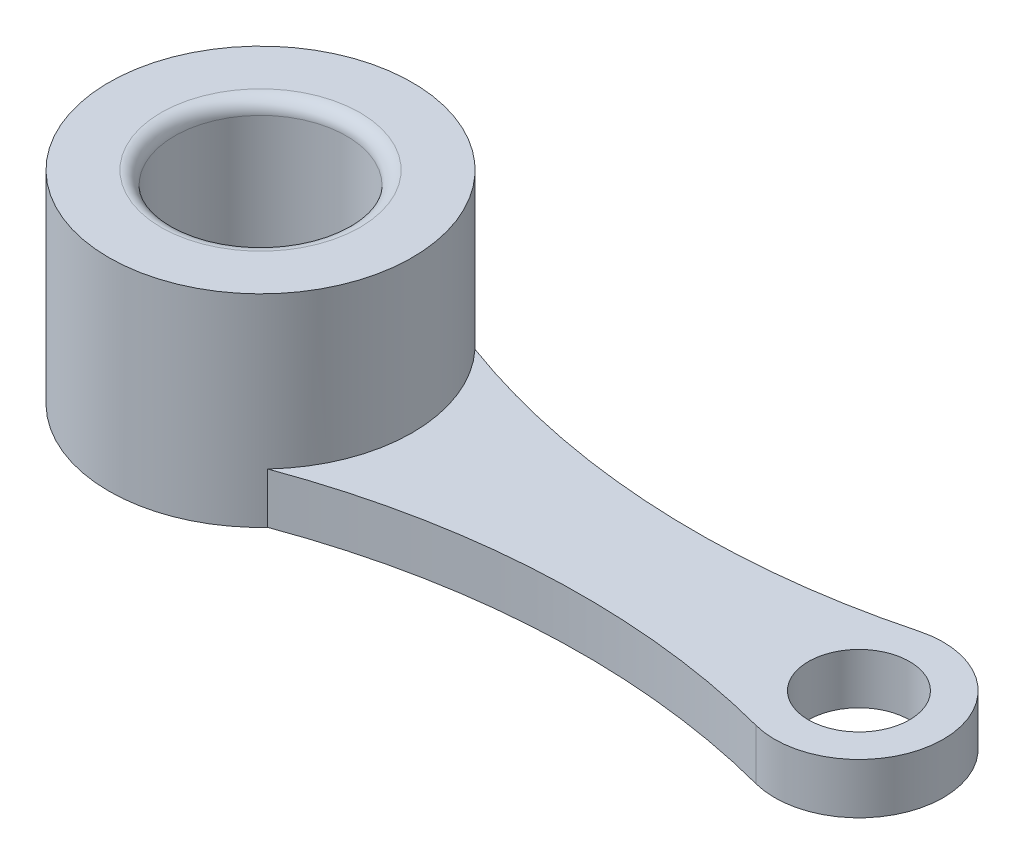
from build123d import *

# Parameters (mm, degrees)
SKETCH2_W               = 25
SKETCH2_H               = 9
BOSS_EXTRUDE3_DEPTH     = 6
SKETCH3_R               = 2.55
CUT_EXTRUDE1_DEPTH      = 5
CUT_EXTRUDE2_DEPTH      = 28.239676944
CUT_EXTRUDE2_DEPTH_BACK = 28.239676944
SKETCH4_R               = 1.5
SKETCH5_R               = 1.5
CUT_EXTRUDE3_DEPTH      = 4.5
CUT_EXTRUDE4_DEPTH      = 28.239676944
FILLET2_R               = 0.4
SKETCH8_R               = 1
CUT_EXTRUDE5_DEPTH      = 28.239676944
CUT_EXTRUDE7_DEPTH      = 10


with BuildPart() as part:
    # Sketch2 → Boss-Extrude3 (new body)
    with BuildSketch(Plane(origin=(0, 0, 0), x_dir=(1, 0, 0), z_dir=(0, 1, 0))):
        with Locations((12.5, 4.5)):
            Rectangle(SKETCH2_W, SKETCH2_H)
    extrude(amount=BOSS_EXTRUDE3_DEPTH)

    # Sketch3 → Cut-Extrude1 (cut)
    with BuildSketch(Plane(origin=(0, 6, 0), x_dir=(1, 0, 0), z_dir=(0, 1, 0))):
        with Locations(Location((4.5, 4.5, 0), (0, 0, 270))):
            Circle(SKETCH3_R)
    extrude(amount=-CUT_EXTRUDE1_DEPTH, mode=Mode.SUBTRACT)

    # Sketch4 → Cut-Extrude2 (cut, two sides: drawn at the far end of the back side and taken through both)
    with BuildSketch(Plane(origin=(0, 6, 0), x_dir=(1, 0, 0), z_dir=(0, 1, 0)).offset(-CUT_EXTRUDE2_DEPTH_BACK)):
        with Locations(Location((22.25, 4.5, 0), (0, 0, 270))):
            Circle(SKETCH4_R)
    extrude(amount=CUT_EXTRUDE2_DEPTH + CUT_EXTRUDE2_DEPTH_BACK, mode=Mode.SUBTRACT)

    # Sketch5 → Cut-Extrude3 (cut)
    with BuildSketch(Plane(origin=(0, 6, 0), x_dir=(1, 0, 0), z_dir=(0, 1, 0))):
        with BuildLine():
            Line((25, 9), (4.5, 9))
            ThreePointArc((4.5, 9), (7.681980515, 7.681980515), (9, 4.5))
            ThreePointArc((9, 4.5), (7.681980515, 1.318019485), (4.5, 0))
            Line((4.5, 0), (25, 0))
            Line((25, 0), (25, 9))
        make_face()
        with Locations(Location((22.25, 4.5, 0), (0, 0, 270))):
            Circle(SKETCH5_R, mode=Mode.SUBTRACT)
    extrude(amount=-CUT_EXTRUDE3_DEPTH, mode=Mode.SUBTRACT)

    # Sketch6 → Cut-Extrude4 (cut, through all)
    with BuildSketch(Plane(origin=(0, 6, 0), x_dir=(1, 0, 0), z_dir=(0, 1, 0))):
        with BuildLine():
            ThreePointArc((0, 4.5), (1.318019485, 7.681980515), (4.5, 9))
            Line((4.5, 9), (0, 9))
            Line((0, 9), (0, 4.5))
        make_face()
        with BuildLine():
            ThreePointArc((4.5, 0), (1.318019485, 1.318019485), (0, 4.5))
            Line((0, 4.5), (0, 0))
            Line((0, 0), (4.5, 0))
        make_face()
    extrude(amount=-CUT_EXTRUDE4_DEPTH, mode=Mode.SUBTRACT)

    # Fillet2
    fillet2_edges = [part.edges().sort_by_distance(p)[0] for p in [
        (4.5, 6, -7.05),
    ]]
    fillet(fillet2_edges, radius=FILLET2_R)

    # Sketch8 → Cut-Extrude5 (cut, through all)
    with BuildSketch(Plane.XZ):
        with Locations(Location((4.5, -4.5, 0), (0, 0, 270))):
            Circle(SKETCH8_R)
    extrude(amount=-CUT_EXTRUDE5_DEPTH, mode=Mode.SUBTRACT)

    # Sketch9 → Cut-Extrude7 (cut)
    with BuildSketch(Plane(origin=(0, 1.5, 0), x_dir=(1, 0, 0), z_dir=(0, 1, 0))):
        with BuildLine():
            Line((25, 9), (4.5, 9))
            ThreePointArc((4.5, 9), (6.291176984, 8.628157581), (7.786338153, 7.574082228))
            ThreePointArc((7.786338153, 7.574082228), (14.648850695, 6.181991531), (21.61241808, 6.917331027))
            ThreePointArc((21.61241808, 6.917331027), (24.75, 4.499999954), (21.612417992, 2.082668996))
            ThreePointArc((21.612417992, 2.082668996), (14.64885065, 2.818008467), (7.786338153, 1.425917772))
            ThreePointArc((7.786338153, 1.425917772), (6.291176984, 0.371842419), (4.5, 0))
            Line((4.5, 0), (25, 0))
            Line((25, 0), (25, 9))
        make_face()
    extrude(amount=-CUT_EXTRUDE7_DEPTH, mode=Mode.SUBTRACT)


solid = part.part
